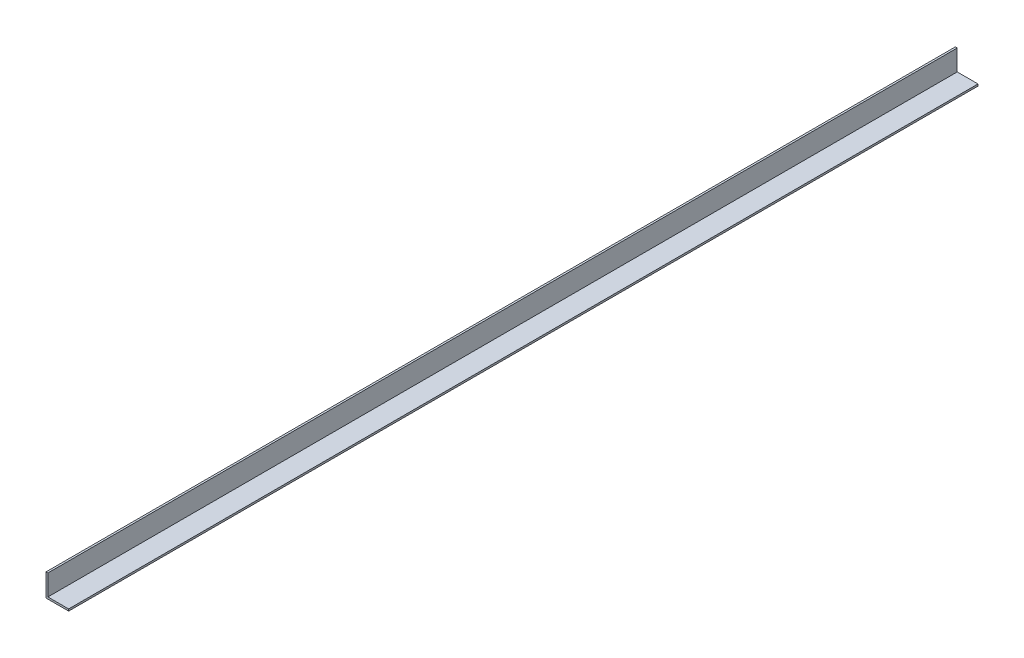
from build123d import *

# Parameters (mm, degrees)
SALIENTE_EXTRUIR1_DEPTH = 6100


with BuildPart() as part:
    # Croquis1 → Saliente-Extruir1 (new body)
    with BuildSketch(Plane.XY):
        Polygon((0, 152), (0, 0), (152, 0), (152, 12.7), (12.7, 12.7), (12.7, 152), align=None)
    extrude(amount=-SALIENTE_EXTRUIR1_DEPTH)


solid = part.part
